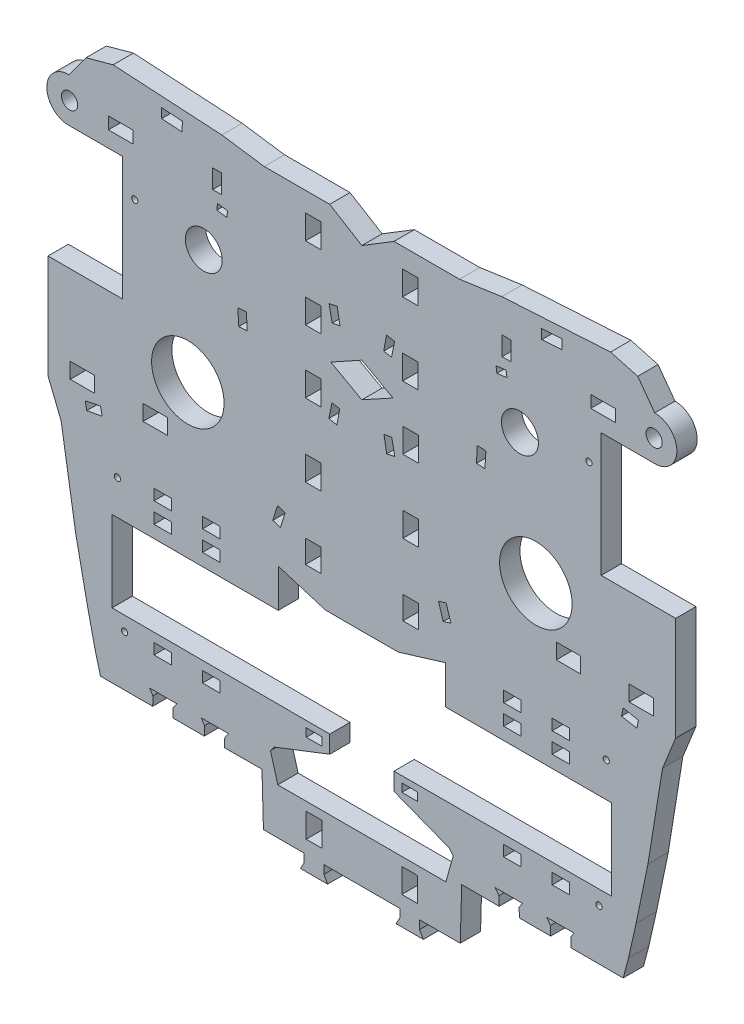
from build123d import *

# Parameters (mm, degrees)
SKETCH_3_R      = 17.842927565
SKETCH_3_R_2    = 9.091712239
SKETCH_3_R_3    = 1.512674152
SKETCH_3_R_4    = 3.999999988
SKETCH_3_R_5    = 1.524035069
SKETCH_3_R_6    = 1.523630153
SKETCH_3_W      = 7.686903531
SKETCH_3_H      = 11.900069989
SKETCH_3_W_2    = 7.687839881
SKETCH_3_H_2    = 11.900072369
SKETCH_3_W_3    = 7.663627049
SKETCH_3_H_3    = 11.951062604
SKETCH_3_W_4    = 7.663627048
SKETCH_3_W_5    = 7.562484622
SKETCH_3_H_4    = 11.291659859
SKETCH_3_W_6    = 11.949670989
SKETCH_3_H_5    = 7.665863515
SKETCH_3_W_7    = 11.949678617
SKETCH_3_W_8    = 8.607025519
SKETCH_3_H_6    = 5.34198926
SKETCH_3_W_9    = 8.607900284
SKETCH_3_H_7    = 5.341989255
SKETCH_3_W_10   = 8.606964481
SKETCH_3_H_8    = 5.342019772
SKETCH_3_W_11   = 8.607961317
SKETCH_3_H_9    = 5.342019778
SKETCH_3_W_12   = 12.085396284
SKETCH_3_H_10   = 5.957181706
SKETCH_3_W_13   = 4.408343956
SKETCH_3_H_11   = 9.289290524
SKETCH_3_W_14   = 8.607961316
SKETCH_3_W_15   = 8.607900281
SKETCH_3_W_16   = 7.709095182
SKETCH_3_H_12   = 4.047897145
SKETCH_3_W_17   = 7.708482225
SKETCH_3_H_13   = 11.92997914
SKETCH_3_W_18   = 4.408343957
SKETCH_3_W_19   = 12.085396283
SKETCH_3_W_20   = 7.562484623
SKETCH_3_W_21   = 7.68690353
EXTRUDE_1_DEPTH = 10


with BuildPart() as part:
    # 草图3 → 凸台-拉伸1 (new body)
    with BuildSketch(Plane.XY):
        with BuildLine():
            Line((60.213865477, 134.612408127), (46.859432423, 138.273546843))
            Line((46.859432423, 138.273546843), (-6.671134382, 135.11978178))
            Line((-6.671134382, 135.11978178), (-27.493285116, 132.128734826))
            Line((-27.493285116, 132.128734826), (-59.738159954, 132.125727825))
            Line((-59.738159954, 132.125727825), (-75.550182165, 122.461358923))
            Line((-75.550182165, 122.461358923), (-91.362204376, 132.125727825))
            Line((-91.362204376, 132.125727825), (-123.607079214, 132.128734826))
            Line((-123.607079214, 132.128734826), (-144.429229948, 135.11978178))
            Line((-144.429229948, 135.11978178), (-197.959796753, 138.273546843))
            Line((-197.959796753, 138.273546843), (-211.314229807, 134.612408127))
            Line((-211.314229807, 134.612408127), (-219.669808901, 123.202329101))
            ThreePointArc((-219.669808901, 123.202329101), (-230.568494081, 112.823669777), (-220.570362395, 101.574880027))
            Line((-220.570362395, 101.574880027), (-193.340950553, 101.572340818))
            Line((-193.340950553, 101.572340818), (-193.348666071, 40.783797485))
            Line((-193.348666071, 40.783797485), (-229.994605675, 40.787214896))
            Line((-229.994605675, 40.787214896), (-229.999367388, -10.275391694))
            Line((-229.999367388, -10.275391694), (-223.519955687, -26.354838148))
            Line((-223.519955687, -26.354838148), (-216.348758824, -70.716865802))
            Line((-216.348758824, -70.716865802), (-210.527821812, -98.926576135))
            Line((-210.527821812, -98.926576135), (-206.777421133, -115.574356361))
            Line((-206.777421133, -115.574356361), (-204.166216486, -125.407180471))
            Line((-204.166216486, -125.407180471), (-178.472061398, -125.382995703))
            Line((-178.472061398, -125.382995703), (-178.35066456, -120.823772385))
            Line((-178.35066456, -120.823772385), (-179.968904071, -118.360273081))
            Line((-179.968904071, -118.360273081), (-166.517488218, -118.362015739))
            Line((-166.517488218, -118.362015739), (-168.393761273, -120.88695675))
            Line((-168.393761273, -120.88695675), (-168.50502047, -125.383925154))
            Line((-168.50502047, -125.383925154), (-153.081131444, -125.38536347))
            Line((-153.081131444, -125.38536347), (-152.959734605, -120.826140151))
            Line((-152.959734605, -120.826140151), (-154.577974116, -118.362640847))
            Line((-154.577974116, -118.362640847), (-141.126558263, -118.364383506))
            Line((-141.126558263, -118.364383506), (-143.002831318, -120.889324516))
            Line((-143.002831318, -120.889324516), (-143.114090515, -125.386292921))
            Line((-143.114090515, -125.386292921), (-124.694403467, -125.286417583))
            Line((-124.694403467, -125.286417583), (-123.974274827, -150.690201976))
            Line((-123.974274827, -150.690201976), (-103.972362094, -150.692067116))
            Line((-103.972362094, -150.692067116), (-103.973686574, -154.854298543))
            Line((-103.973686574, -154.854298543), (-105.82030652, -158.140747449))
            Line((-105.82030652, -158.140747449), (-92.394281248, -158.141999459))
            Line((-92.394281248, -158.141999459), (-94.209566723, -154.855208984))
            Line((-94.209566723, -154.855208984), (-94.209178585, -150.692977556))
            Line((-94.209178585, -150.692977556), (-75.550182165, -150.694717553))
            Line((-75.550182165, -150.694717553), (-56.891185745, -150.692977556))
            Line((-56.891185745, -150.692977556), (-56.890797607, -154.855208984))
            Line((-56.890797607, -154.855208984), (-58.706083082, -158.141999459))
            Line((-58.706083082, -158.141999459), (-45.28005781, -158.140747449))
            Line((-45.28005781, -158.140747449), (-47.126677756, -154.854298543))
            Line((-47.126677756, -154.854298543), (-47.128002237, -150.692067116))
            Line((-47.128002237, -150.692067116), (-27.126089504, -150.690201976))
            Line((-27.126089504, -150.690201976), (-26.405960864, -125.286417583))
            Line((-26.405960864, -125.286417583), (-7.986273816, -125.386292921))
            Line((-7.986273816, -125.386292921), (-8.097533013, -120.889324516))
            Line((-8.097533013, -120.889324516), (-9.973806067, -118.364383506))
            Line((-9.973806067, -118.364383506), (3.477609786, -118.362640847))
            Line((3.477609786, -118.362640847), (1.859370275, -120.826140151))
            Line((1.859370275, -120.826140151), (1.980767113, -125.38536347))
            Line((1.980767113, -125.38536347), (17.404656139, -125.383925154))
            Line((17.404656139, -125.383925154), (17.293396942, -120.88695675))
            Line((17.293396942, -120.88695675), (15.417123888, -118.362015739))
            Line((15.417123888, -118.362015739), (28.868539741, -118.360273081))
            Line((28.868539741, -118.360273081), (27.25030023, -120.823772385))
            Line((27.25030023, -120.823772385), (27.371697068, -125.382995703))
            Line((27.371697068, -125.382995703), (53.065852156, -125.407180471))
            Line((53.065852156, -125.407180471), (55.677056803, -115.574356361))
            Line((55.677056803, -115.574356361), (59.427457482, -98.926576135))
            Line((59.427457482, -98.926576135), (65.248394493, -70.716865802))
            Line((65.248394493, -70.716865802), (72.419591357, -26.354838148))
            Line((72.419591357, -26.354838148), (78.899003057, -10.275391694))
            Line((78.899003057, -10.275391694), (78.894241345, 40.787214896))
            Line((78.894241345, 40.787214896), (42.248301741, 40.783797485))
            Line((42.248301741, 40.783797485), (42.240586223, 101.572340818))
            Line((42.240586223, 101.572340818), (69.469998065, 101.574880027))
            ThreePointArc((69.469998065, 101.574880027), (79.468129751, 112.823669777), (68.569444571, 123.202329101))
            Line((68.569444571, 123.202329101), (60.213865477, 134.612408127))
        make_face()
        with Locations((10.085973221, 21.322451707)):
            Circle(SKETCH_3_R, mode=Mode.SUBTRACT)
        with Locations((2.2426955, 81.732121579)):
            Circle(SKETCH_3_R_2, mode=Mode.SUBTRACT)
        with Locations((36.208489214, 86.147890944)):
            Circle(SKETCH_3_R_3, mode=Mode.SUBTRACT)
        with Locations((68.283340873, 112.335999874)):
            Circle(SKETCH_3_R_4, mode=Mode.SUBTRACT)
        with Locations((44.736877975, -36.587046713)):
            Circle(SKETCH_3_R_5, mode=Mode.SUBTRACT)
        with Locations((41.171615071, -100.519838676)):
            Circle(SKETCH_3_R_6, mode=Mode.SUBTRACT)
        with Locations((-192.271979402, -100.519838676)):
            Circle(SKETCH_3_R_6, mode=Mode.SUBTRACT)
        with Locations((-195.837242305, -36.587046713)):
            Circle(SKETCH_3_R_5, mode=Mode.SUBTRACT)
        with Locations((-219.383705203, 112.335999874)):
            Circle(SKETCH_3_R_4, mode=Mode.SUBTRACT)
        with Locations((-187.308853545, 86.147890944)):
            Circle(SKETCH_3_R_3, mode=Mode.SUBTRACT)
        with Locations((-153.34305983, 81.732121579)):
            Circle(SKETCH_3_R_2, mode=Mode.SUBTRACT)
        with Locations((-161.186337551, 21.322451707)):
            Circle(SKETCH_3_R, mode=Mode.SUBTRACT)
        Polygon((-57.539244052, -41.836653326), (-75.550182165, -41.916111444), (-93.561120279, -41.836653326), (-116.679858623, -34.765161392), (-116.681616275, -53.613488947), (-198.478368494, -53.6058612), (-198.482082549, -93.433833526), (-91.348146488, -93.652045376), (-91.348948747, -102.255133718), (-118.661460773, -112.856346571), (-120.506655348, -115.257053419), (-116.909094554, -128.061954385), (-34.191269776, -128.061954385), (-30.593708982, -115.257053419), (-32.438903557, -112.856346571), (-59.751415583, -102.255133718), (-59.752217842, -93.652045376), (47.381718219, -93.433833526), (47.378004164, -53.6058612), (-34.418748055, -53.613488947), (-34.420505707, -34.765161392), align=None, mode=Mode.SUBTRACT)
        Polygon((22.918297487, 131.979016883), (12.723055531, 131.263436022), (12.991657288, 126.606600698), (22.975203483, 127.302691603), align=None, mode=Mode.SUBTRACT)
        with Locations((-51.662773268, 116.544358048)):
            Rectangle(SKETCH_3_W, SKETCH_3_H, mode=Mode.SUBTRACT)
        with Locations((-51.659898746, 80.698747822)):
            Rectangle(SKETCH_3_W_2, SKETCH_3_H_2, mode=Mode.SUBTRACT)
        with Locations((-51.554880416, 49.571391177)):
            Rectangle(SKETCH_3_W_3, SKETCH_3_H_3, mode=Mode.SUBTRACT)
        with Locations((-51.551530095, 13.725779761)):
            Rectangle(SKETCH_3_W_4, SKETCH_3_H_3, mode=Mode.SUBTRACT)
        with Locations((-51.558517654, -21.75110398)):
            Rectangle(SKETCH_3_W_5, SKETCH_3_H_4, mode=Mode.SUBTRACT)
        with Locations((26.131580655, -2.481583408)):
            Rectangle(SKETCH_3_W_6, SKETCH_3_H_5, mode=Mode.SUBTRACT)
        with Locations((61.977187508, -2.478240718)):
            Rectangle(SKETCH_3_W_7, SKETCH_3_H_5, mode=Mode.SUBTRACT)
        with Locations((22.414958473, -34.816898743)):
            Rectangle(SKETCH_3_W_8, SKETCH_3_H_6, mode=Mode.SUBTRACT)
        with Locations((-1.458708683, -34.819124978)):
            Rectangle(SKETCH_3_W_9, SKETCH_3_H_7, mode=Mode.SUBTRACT)
        with Locations((-1.457306139, -44.841845271)):
            Rectangle(SKETCH_3_W_10, SKETCH_3_H_8, mode=Mode.SUBTRACT)
        with Locations((22.415425216, -44.839619037)):
            Rectangle(SKETCH_3_W_11, SKETCH_3_H_9, mode=Mode.SUBTRACT)
        with Locations((43.152597218, 112.368354867)):
            Rectangle(SKETCH_3_W_12, SKETCH_3_H_10, mode=Mode.SUBTRACT)
        Polygon((-4.540581593, 104.863571636), (-9.481212326, 104.237805732), (-9.101572041, 101.19337701), (-4.160463588, 101.850576064), align=None, mode=Mode.SUBTRACT)
        with Locations((-4.335733896, 114.247898641)):
            Rectangle(SKETCH_3_W_13, SKETCH_3_H_11, mode=Mode.SUBTRACT)
        Polygon((-14.48648645, 65.440585879), (-18.735006644, 65.689213133), (-19.149333515, 57.823726376), (-15.003073419, 57.634446364), align=None, mode=Mode.SUBTRACT)
        Polygon((-34.054561927, -9.109579059), (-37.836246539, -10.280006266), (-35.511482435, -17.746596759), (-31.742868239, -16.580463374), align=None, mode=Mode.SUBTRACT)
        Polygon((-59.431978896, 89.623803155), (-63.397225467, 90.446701871), (-64.78345924, 82.829969038), (-60.946887465, 82.133316817), align=None, mode=Mode.SUBTRACT)
        with Locations((22.420617676, -100.52138149)):
            Rectangle(SKETCH_3_W_14, SKETCH_3_H_9, mode=Mode.SUBTRACT)
        with Locations((-1.45258158, -100.523607724)):
            Rectangle(SKETCH_3_W_15, SKETCH_3_H_8, mode=Mode.SUBTRACT)
        with Locations((-52.043490732, -98.747427364)):
            Rectangle(SKETCH_3_W_16, SKETCH_3_H_12, mode=Mode.SUBTRACT)
        with Locations((-52.039863784, -138.295827107)):
            Rectangle(SKETCH_3_W_17, SKETCH_3_H_13, mode=Mode.SUBTRACT)
        Polygon((-60.841615049, 48.129988661), (-64.678959977, 47.432456744), (-63.291271554, 39.815795345), (-59.325276295, 40.639620998), align=None, mode=Mode.SUBTRACT)
        Polygon((-60.247268473, 65.131509003), (-75.550182165, 73.597602269), (-90.853095857, 65.131509003), (-75.550182165, 56.710799961), align=None, mode=Mode.SUBTRACT)
        Polygon((60.53750944, -11.765247875), (53.048835578, -10.250704287), (52.225817027, -14.216447253), (59.840685607, -15.602760992), align=None, mode=Mode.SUBTRACT)
        Polygon((-210.941049937, -15.602760992), (-211.63787377, -11.765247875), (-204.149199908, -10.250704287), (-203.326181357, -14.216447253), align=None, mode=Mode.SUBTRACT)
        Polygon((-91.775088035, 40.639620998), (-90.258749281, 48.129988661), (-86.421404353, 47.432456744), (-87.809092776, 39.815795345), align=None, mode=Mode.SUBTRACT)
        Polygon((-90.153476865, 82.133316817), (-91.668385435, 89.623803155), (-87.703138864, 90.446701871), (-86.31690509, 82.829969038), align=None, mode=Mode.SUBTRACT)
        with Locations((-99.060500547, -138.295827107)):
            Rectangle(SKETCH_3_W_17, SKETCH_3_H_13, mode=Mode.SUBTRACT)
        with Locations((-99.056873598, -98.747427364)):
            Rectangle(SKETCH_3_W_16, SKETCH_3_H_12, mode=Mode.SUBTRACT)
        with Locations((-149.647782751, -100.523607724)):
            Rectangle(SKETCH_3_W_15, SKETCH_3_H_8, mode=Mode.SUBTRACT)
        with Locations((-173.520982006, -100.52138149)):
            Rectangle(SKETCH_3_W_14, SKETCH_3_H_9, mode=Mode.SUBTRACT)
        Polygon((-119.357496091, -16.580463374), (-117.045802404, -9.109579059), (-113.264117791, -10.280006266), (-115.588881895, -17.746596759), align=None, mode=Mode.SUBTRACT)
        Polygon((-136.097290911, 57.634446364), (-136.61387788, 65.440585879), (-132.365357686, 65.689213133), (-131.951030816, 57.823726376), align=None, mode=Mode.SUBTRACT)
        Polygon((-146.939900742, 101.850576064), (-146.559782737, 104.863571636), (-141.619152004, 104.237805732), (-141.998792289, 101.19337701), align=None, mode=Mode.SUBTRACT)
        with Locations((-146.764630435, 114.247898641)):
            Rectangle(SKETCH_3_W_18, SKETCH_3_H_11, mode=Mode.SUBTRACT)
        Polygon((-174.075567813, 127.302691603), (-174.018661817, 131.979016883), (-163.823419861, 131.263436022), (-164.092021618, 126.606600698), align=None, mode=Mode.SUBTRACT)
        with Locations((-194.252961549, 112.368354867)):
            Rectangle(SKETCH_3_W_19, SKETCH_3_H_10, mode=Mode.SUBTRACT)
        with Locations((-173.515789546, -44.839619037)):
            Rectangle(SKETCH_3_W_14, SKETCH_3_H_9, mode=Mode.SUBTRACT)
        with Locations((-149.643058191, -44.841845271)):
            Rectangle(SKETCH_3_W_10, SKETCH_3_H_8, mode=Mode.SUBTRACT)
        with Locations((-149.641655647, -34.819124978)):
            Rectangle(SKETCH_3_W_9, SKETCH_3_H_7, mode=Mode.SUBTRACT)
        with Locations((-173.515322803, -34.816898743)):
            Rectangle(SKETCH_3_W_8, SKETCH_3_H_6, mode=Mode.SUBTRACT)
        with Locations((-213.077551838, -2.478240718)):
            Rectangle(SKETCH_3_W_7, SKETCH_3_H_5, mode=Mode.SUBTRACT)
        with Locations((-177.231944984, -2.481583408)):
            Rectangle(SKETCH_3_W_6, SKETCH_3_H_5, mode=Mode.SUBTRACT)
        with Locations((-99.541846677, -21.75110398)):
            Rectangle(SKETCH_3_W_20, SKETCH_3_H_4, mode=Mode.SUBTRACT)
        with Locations((-99.548834236, 13.725779761)):
            Rectangle(SKETCH_3_W_3, SKETCH_3_H_3, mode=Mode.SUBTRACT)
        with Locations((-99.545483916, 49.571391177)):
            Rectangle(SKETCH_3_W_3, SKETCH_3_H_3, mode=Mode.SUBTRACT)
        with Locations((-99.440465585, 80.698747822)):
            Rectangle(SKETCH_3_W_2, SKETCH_3_H_2, mode=Mode.SUBTRACT)
        with Locations((-99.437591063, 116.544358048)):
            Rectangle(SKETCH_3_W_21, SKETCH_3_H, mode=Mode.SUBTRACT)
    extrude(amount=EXTRUDE_1_DEPTH)


solid = part.part
